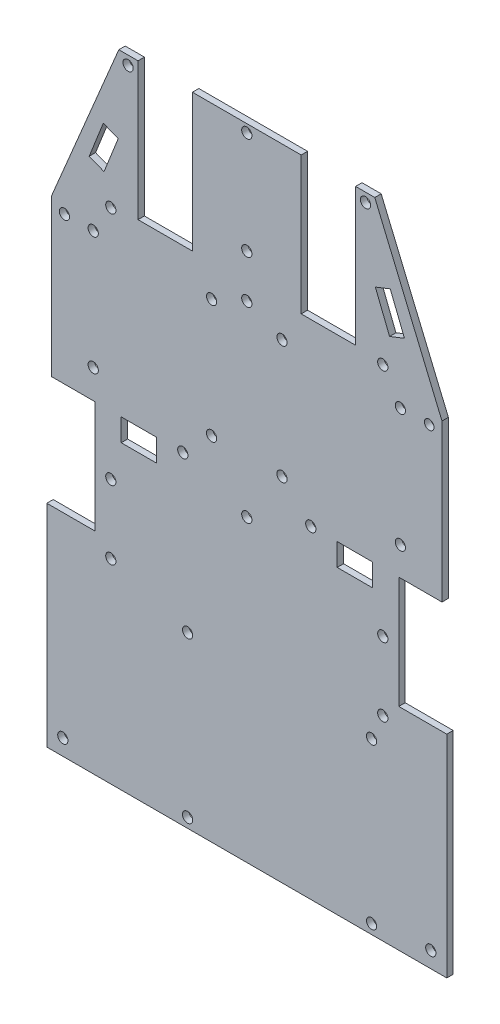
from build123d import *

# Parameters (mm, degrees)
SKETCH_1_R      = 1.6
SKETCH_1_W      = 11
SKETCH_1_H      = 7
SKETCH_1_R_2    = 1.5
EXTRUDE_1_DEPTH = 2


with BuildPart() as part:
    # 草圖1 → 填料-伸長1 (new body)
    with BuildSketch(Plane.XY):
        Polygon((62.5, 0), (62.5, 66), (47.5, 66), (47.5, 101), (61, 101), (61, 150), (40, 200), (34, 200), (34, 157), (17, 157), (17, 200), (-17, 200), (-17, 157), (-34, 157), (-34, 200), (-40, 200), (-61, 150), (-61, 101), (-47.5, 101), (-47.5, 66), (-62.5, 66), (-62.5, 0), align=None)
        with Locations((-18.5, 3)):
            Circle(SKETCH_1_R, mode=Mode.SUBTRACT)
        with Locations((-18.5, 53)):
            Circle(SKETCH_1_R, mode=Mode.SUBTRACT)
        with Locations((39, 3)):
            Circle(SKETCH_1_R, mode=Mode.SUBTRACT)
        with Locations((39, 53)):
            Circle(SKETCH_1_R, mode=Mode.SUBTRACT)
        Polygon((40.18903792, 175.844265317), (44.837242241, 177.686599868), (49.258845161, 166.530909498), (44.610640841, 164.688574948), align=None, mode=Mode.SUBTRACT)
        with Locations((0, 197.5)):
            Circle(SKETCH_1_R, mode=Mode.SUBTRACT)
        with Locations((37.09943713, 197.209058014)):
            Circle(SKETCH_1_R, mode=Mode.SUBTRACT)
        with Locations((-57.5, 5)):
            Circle(SKETCH_1_R, mode=Mode.SUBTRACT)
        with Locations((-42.5, 61)):
            Circle(SKETCH_1_R, mode=Mode.SUBTRACT)
        with Locations((-42.5, 82.5)):
            Circle(SKETCH_1_R, mode=Mode.SUBTRACT)
        with Locations((-33.75, 97.5)):
            Rectangle(SKETCH_1_W, SKETCH_1_H, mode=Mode.SUBTRACT)
        with Locations((57.5, 5)):
            Circle(SKETCH_1_R, mode=Mode.SUBTRACT)
        with Locations((42.5, 61)):
            Circle(SKETCH_1_R, mode=Mode.SUBTRACT)
        with Locations((0, 93.5)):
            Circle(SKETCH_1_R, mode=Mode.SUBTRACT)
        with Locations((42.5, 82.5)):
            Circle(SKETCH_1_R, mode=Mode.SUBTRACT)
        with Locations((33.75, 97.5)):
            Rectangle(SKETCH_1_W, SKETCH_1_H, mode=Mode.SUBTRACT)
        with Locations((-56.996650272, 147.008451352)):
            Circle(SKETCH_1_R, mode=Mode.SUBTRACT)
        with Locations((-20, 101)):
            Circle(SKETCH_1_R, mode=Mode.SUBTRACT)
        with Locations((-42.5, 156)):
            Circle(SKETCH_1_R, mode=Mode.SUBTRACT)
        Polygon((-44.837242241, 177.686599868), (-40.18903792, 175.844265317), (-44.610640841, 164.688574948), (-49.258845161, 166.530909498), align=None, mode=Mode.SUBTRACT)
        with Locations((-37.09943713, 197.209058014)):
            Circle(SKETCH_1_R, mode=Mode.SUBTRACT)
        with Locations((20, 101)):
            Circle(SKETCH_1_R, mode=Mode.SUBTRACT)
        with Locations((56.996650272, 147.008451352)):
            Circle(SKETCH_1_R_2, mode=Mode.SUBTRACT)
        with Locations((0, 152)):
            Circle(SKETCH_1_R, mode=Mode.SUBTRACT)
        with Locations((0, 165.5)):
            Circle(SKETCH_1_R, mode=Mode.SUBTRACT)
        with Locations((42.5, 156)):
            Circle(SKETCH_1_R, mode=Mode.SUBTRACT)
        with Locations((47.996650272, 110)):
            Circle(SKETCH_1_R, mode=Mode.SUBTRACT)
        with Locations((11, 147)):
            Circle(SKETCH_1_R, mode=Mode.SUBTRACT)
        with Locations((11, 110)):
            Circle(SKETCH_1_R, mode=Mode.SUBTRACT)
        with Locations((47.996650272, 147)):
            Circle(SKETCH_1_R, mode=Mode.SUBTRACT)
        with Locations((-11, 110)):
            Circle(SKETCH_1_R, mode=Mode.SUBTRACT)
        with Locations((-48, 147)):
            Circle(SKETCH_1_R, mode=Mode.SUBTRACT)
        with Locations((-48, 110)):
            Circle(SKETCH_1_R, mode=Mode.SUBTRACT)
        with Locations((-11, 147)):
            Circle(SKETCH_1_R, mode=Mode.SUBTRACT)
    extrude(amount=EXTRUDE_1_DEPTH)


solid = part.part
